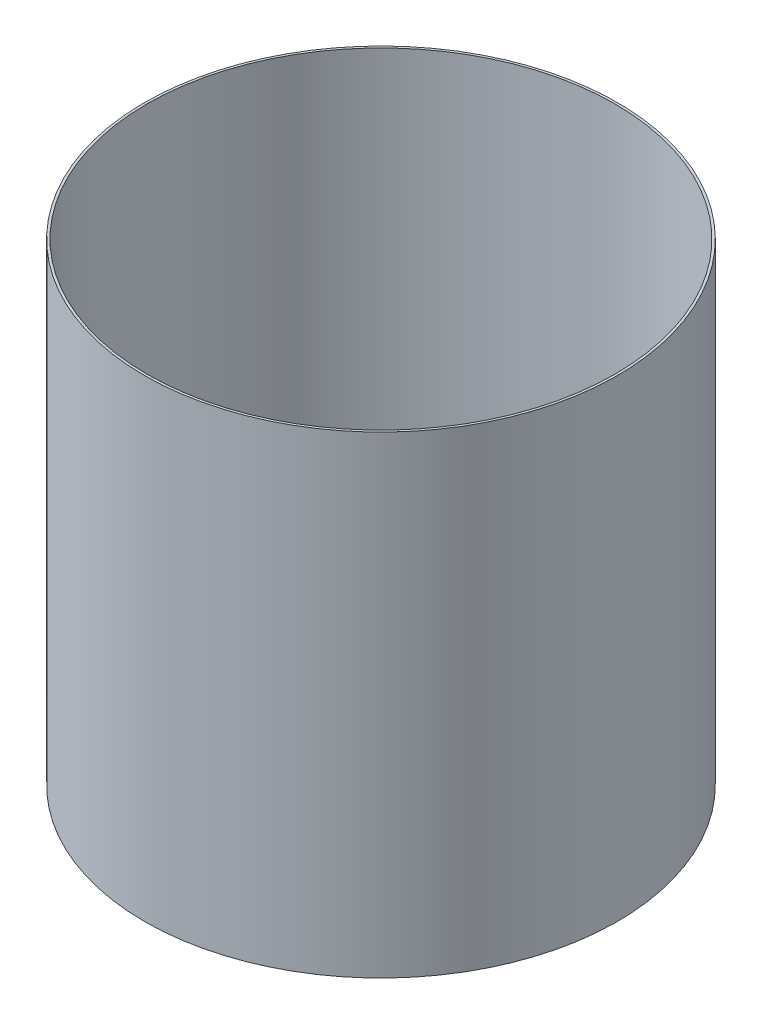
from build123d import *

# Parameters (mm, degrees)
SKETCH1_R           = 100
SKETCH1_R_2         = 99
BOSS_EXTRUDE1_DEPTH = 200


with BuildPart() as part:
    # Sketch1 → Boss-Extrude1 (new body)
    with BuildSketch(Plane(origin=(0, 0, 0), x_dir=(1, 0, 0), z_dir=(0, 1, 0))):
        with Locations(Location((0, 0, 0), (0, 0, 270))):
            Circle(SKETCH1_R)
        with Locations(Location((0, 0, 0), (0, 0, 270))):
            Circle(SKETCH1_R_2, mode=Mode.SUBTRACT)
    extrude(amount=BOSS_EXTRUDE1_DEPTH)


solid = part.part
